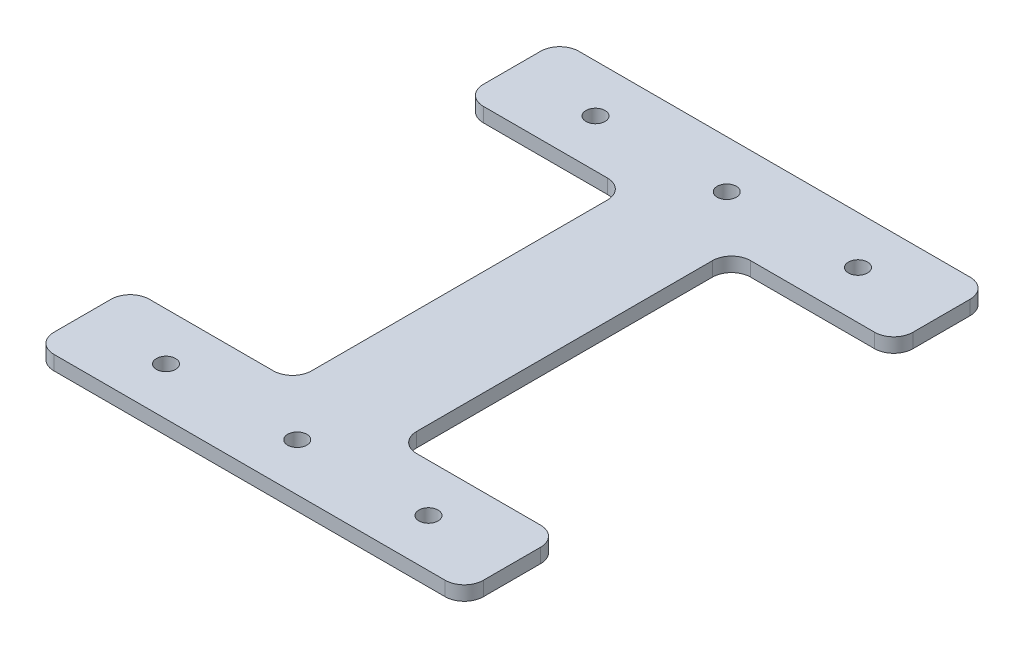
from build123d import *

# Parameters (mm, degrees)
SKETCH_1_W      = 22
SKETCH_1_H      = 70
SKETCH_1_R      = 2
EXTRUDE_1_DEPTH = 3
FILLET_1_R      = 4


with BuildPart() as part:
    # 草图1 → 凸台-拉伸1 (new body)
    # profile 1 of 3: a face of its own
    with BuildSketch(Plane(origin=(0, 0, 0), x_dir=(1, 0, 0), z_dir=(0, 1, 0))):
        Rectangle(SKETCH_1_W, SKETCH_1_H)
    # profile 2 of 3: a face of its own
    with BuildSketch(Plane(origin=(0, 0, 0), x_dir=(1, 0, 0), z_dir=(0, 1, 0))):
        Polygon((-45, 35), (-11, 35), (11, 35), (45, 35), (45, 55), (-45, 55), align=None)
        with Locations(Location((-27.5, 45, 0), (0, 0, 270))):
            Circle(SKETCH_1_R, mode=Mode.SUBTRACT)
        with Locations(Location((0, 45, 0), (0, 0, 270))):
            Circle(SKETCH_1_R, mode=Mode.SUBTRACT)
        with Locations(Location((27.5, 45, 0), (0, 0, 270))):
            Circle(SKETCH_1_R, mode=Mode.SUBTRACT)
    # profile 3 of 3: a face of its own
    with BuildSketch(Plane(origin=(0, 0, 0), x_dir=(1, 0, 0), z_dir=(0, 1, 0))):
        Polygon((11, -35), (-11, -35), (-45, -35), (-45, -55), (45, -55), (45, -35), align=None)
        with Locations(Location((-27.5, -45, 0), (0, 0, 270))):
            Circle(SKETCH_1_R, mode=Mode.SUBTRACT)
        with Locations(Location((0, -45, 0), (0, 0, 270))):
            Circle(SKETCH_1_R, mode=Mode.SUBTRACT)
        with Locations(Location((27.5, -45, 0), (0, 0, 270))):
            Circle(SKETCH_1_R, mode=Mode.SUBTRACT)
    extrude(amount=EXTRUDE_1_DEPTH)

    # 圆角1
    fillet_1_edges = [part.edges().sort_by_distance(p)[0] for p in [
        (11, 1.5, 35),
        (45, 1.5, 35),
        (45, 1.5, 55),
        (-45, 1.5, 55),
        (-45, 1.5, 35),
        (-11, 1.5, 35),
        (-11, 1.5, -35),
        (-45, 1.5, -35),
        (-45, 1.5, -55),
        (45, 1.5, -55),
        (45, 1.5, -35),
        (11, 1.5, -35),
    ]]
    fillet(fillet_1_edges, radius=FILLET_1_R)


solid = part.part
